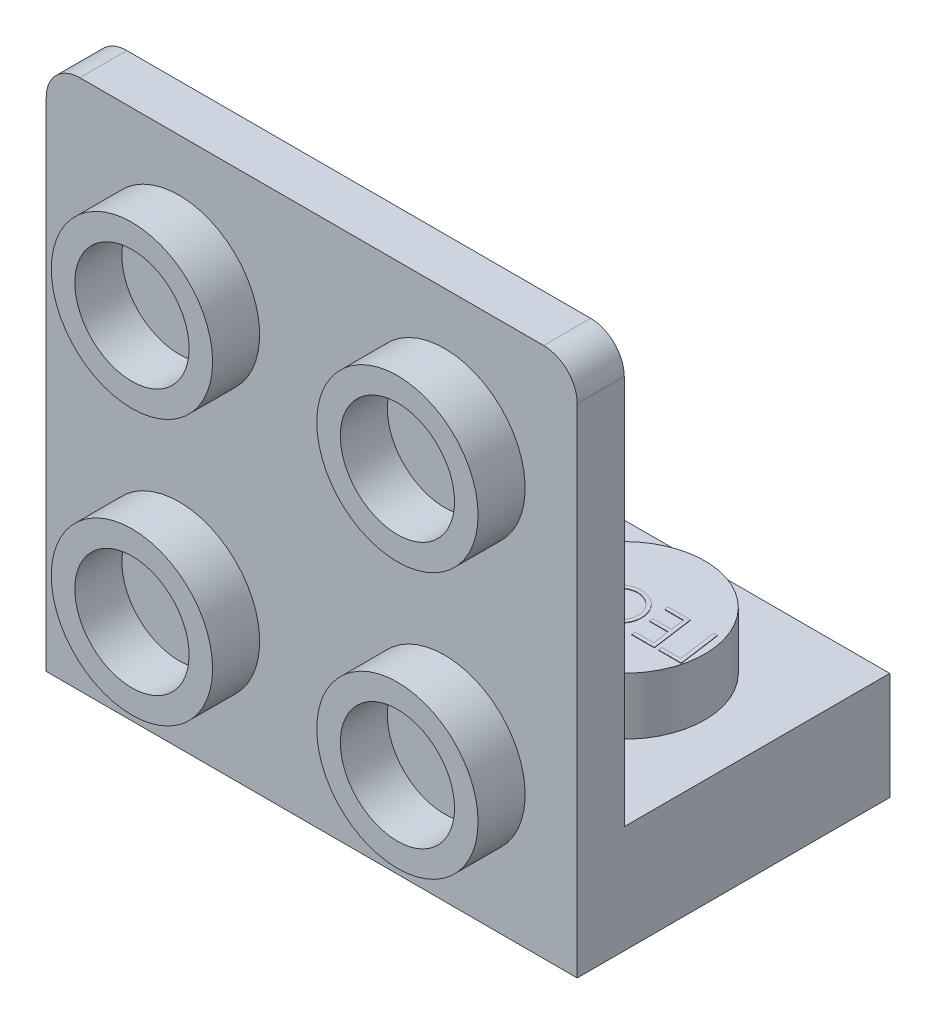
from build123d import *

# Parameters (mm, degrees)
SKETCH1_W           = 7.9
SKETCH1_H           = 7.9
BOSS_EXTRUDE1_DEPTH = 3.2
SKETCH2_R           = 2.4
BOSS_EXTRUDE2_DEPTH = 1.7
BOSS_EXTRUDE4_DEPTH = 0.01
SKETCH4_W           = 6.679581062
SKETCH4_H           = 6.679581062
CUT_EXTRUDE1_DEPTH  = 2.01
BOSS_EXTRUDE5_START = -2.01
BOSS_EXTRUDE5_DEPTH = 2.01
SKETCH6_W           = 15.8
SKETCH6_H           = 15.8
BOSS_EXTRUDE6_DEPTH = 1.4
SKETCH7_R           = 2.4
SKETCH7_R_2         = 1.7
BOSS_EXTRUDE7_DEPTH = 1.4
FILLET1_R           = 1


with BuildPart() as part:
    # Sketch1 → Boss-Extrude1 (new body)
    with BuildSketch(Plane(origin=(0, 0, 0), x_dir=(1, 0, 0), z_dir=(0, 1, 0))):
        with Locations((3.95, 3.95)):
            Rectangle(SKETCH1_W, SKETCH1_H)
    extrude(amount=BOSS_EXTRUDE1_DEPTH)

    # Sketch2 → Boss-Extrude2 (add)
    with BuildSketch(Plane(origin=(0, 3.2, 0), x_dir=(1, 0, 0), z_dir=(0, 1, 0))):
        with Locations(Location((3.95, 3.95, 0), (0, 0, 270))):
            Circle(SKETCH2_R)
    extrude(amount=BOSS_EXTRUDE2_DEPTH)

    # Sketch3 → Boss-Extrude4 (add)
    # profile 1 of 4: a face of its own
    with BuildSketch(Plane(origin=(0, 4.9, 0), x_dir=(1, 0, 0), z_dir=(0, 1, 0))):
        Polygon((1.832282536, 4.604898123), (1.945463626, 4.604898123), (1.785708017, 3.46707761), (2.346104652, 3.46707761), (2.331831815, 3.354898123), (1.657002088, 3.354898123), align=None)
    # profile 2 of 4: a face of its own
    with BuildSketch(Plane(origin=(0, 4.9, 0), x_dir=(1, 0, 0), z_dir=(0, 1, 0))):
        Polygon((3.307643113, 4.604898123), (3.289864668, 4.492718636), (2.730720036, 4.492718636), (2.672376687, 4.076051969), (3.227514908, 4.076051969), (3.211489267, 3.963872482), (2.656351046, 3.963872482), (2.586990069, 3.46707761), (3.147386703, 3.46707761), (3.132863466, 3.354898123), (2.458284139, 3.354898123), (2.633564588, 4.604898123), align=None)
    # profile 3 of 4: a face of its own
    with BuildSketch(Plane(origin=(0, 4.9, 0), x_dir=(1, 0, 0), z_dir=(0, 1, 0))):
        with BuildLine():
            Line((4.701873883, 4.341727049), (4.602214428, 4.268359661))
            add(Edge.make_bspline(
                [(4.602214428, 4.268359661), (4.594223081, 4.278463296), (4.578382454, 4.298490949), (4.552974208, 4.326751799), (4.526781942, 4.353389692), (4.49925824, 4.377917229), (4.471083571, 4.40112998), (4.441525281, 4.42204341), (4.410978563, 4.441207159), (4.379659496, 4.458649755), (4.347610579, 4.474125482), (4.315396207, 4.487732834), (4.282869127, 4.498922357), (4.250283005, 4.50864136), (4.217299487, 4.51587276), (4.18414763, 4.520710487), (4.150903008, 4.524293062), (4.128633082, 4.524610402), (4.117438786, 4.524769918)],
                knots=[0, 0, 0, 0, 1.088205139, 2.157064813, 3.209299296, 4.24303109, 5.270682624, 6.292193363, 7.299904734, 8.316436989, 9.319473328, 10.305733085, 11.269264382, 12.22444877, 13.177574148, 14.119122834, 15.054550362, 16, 16, 16, 16], degree=3))
            add(Edge.make_bspline(
                [(4.117438786, 4.524769918), (4.104994375, 4.524521107), (4.080132736, 4.524024028), (4.043033101, 4.520256885), (4.006376299, 4.51354748), (3.969908323, 4.504926578), (3.933893833, 4.493301772), (3.898252767, 4.479273564), (3.86309309, 4.462612711), (3.828430169, 4.443710217), (3.794953431, 4.422557236), (3.762954424, 4.399818018), (3.733183783, 4.375017311), (3.704650221, 4.34913067), (3.678490591, 4.320990985), (3.654040353, 4.291325456), (3.631570613, 4.259970376), (3.610753816, 4.22729124), (3.592321888, 4.193377608), (3.576332398, 4.158696131), (3.562301633, 4.123622124), (3.551463822, 4.087613068), (3.542488613, 4.051135011), (3.536702509, 4.013925289), (3.532682003, 3.976230124), (3.532229884, 3.950862463), (3.532002088, 3.938081216)],
                knots=[0, 0, 0, 0, 0.97704485, 1.95195533, 2.923843304, 3.901415526, 4.89212417, 5.89249681, 6.906854198, 7.94508701, 8.99059592, 10.014519948, 11.024825533, 12.031297736, 13.037428488, 14.038509295, 15.047964276, 16.064309815, 17.079005887, 18.075937854, 19.061713623, 20.042247028, 21.026191147, 22.008802999, 22.996754876, 24, 24, 24, 24], degree=3))
            add(Edge.make_bspline(
                [(3.532002088, 3.938081216), (3.532369323, 3.920940483), (3.533092921, 3.887166428), (3.54080397, 3.83756171), (3.552297071, 3.789703796), (3.569345009, 3.743984102), (3.590663785, 3.700113704), (3.616898701, 3.658340736), (3.647995923, 3.618632516), (3.683169388, 3.581124089), (3.721975609, 3.547190184), (3.762989457, 3.517071082), (3.806208637, 3.491553815), (3.851780792, 3.471217023), (3.899058754, 3.454481236), (3.948703848, 3.443615036), (4.000192874, 3.436168993), (4.035279814, 3.435410998), (4.053085822, 3.435026328)],
                knots=[0, 0, 0, 0, 1.019699772, 2.00921373, 2.981850619, 3.945611549, 4.907936516, 5.881372837, 6.876399243, 7.906447893, 8.938173367, 9.941073143, 10.932270214, 11.919723139, 12.908225854, 13.912405215, 14.940582182, 16, 16, 16, 16], degree=3))
            add(Edge.make_bspline(
                [(4.053085822, 3.435026328), (4.074581254, 3.435599426), (4.11748625, 3.436743331), (4.180872469, 3.447608002), (4.243162184, 3.464003995), (4.303115661, 3.48756372), (4.359892332, 3.516274774), (4.411741714, 3.54979345), (4.457784869, 3.587961635), (4.498384943, 3.630580026), (4.53303885, 3.678554542), (4.563120551, 3.731230233), (4.587740602, 3.789373269), (4.599634966, 3.830601123), (4.605720036, 3.851692995)],
                knots=[0, 0, 0, 0, 1.033792167, 2.063454529, 3.086685911, 4.12966393, 5.157365104, 6.144632769, 7.094686579, 8.02963692, 8.969786061, 9.935985671, 10.944065236, 12, 12, 12, 12], degree=3))
            Line((4.605720036, 3.851692995), (4.140976447, 3.851692995))
            Line((4.140976447, 3.851692995), (4.140976447, 3.963872482))
            Line((4.140976447, 3.963872482), (4.717899524, 3.963872482))
            add(Edge.make_bspline(
                [(4.717899524, 3.963872482), (4.715864452, 3.940537279), (4.711874195, 3.894782885), (4.69942647, 3.828086612), (4.68199329, 3.764774229), (4.659173945, 3.704861641), (4.630919519, 3.648505742), (4.59774963, 3.595348644), (4.559285746, 3.545571633), (4.515814341, 3.499721655), (4.46844757, 3.458302738), (4.417878433, 3.421925394), (4.364351012, 3.391393009), (4.308182236, 3.366007973), (4.248908241, 3.346854494), (4.187007442, 3.33278705), (4.12217798, 3.324364805), (4.078067373, 3.323359246), (4.055589828, 3.322846841)],
                knots=[0, 0, 0, 0, 1.098006248, 2.152910829, 3.176693714, 4.174102283, 5.154427425, 6.128677043, 7.108165613, 8.099464247, 9.087077226, 10.054952015, 11.015803916, 11.972468591, 12.940477937, 13.931877037, 14.946141749, 16, 16, 16, 16], degree=3))
            add(Edge.make_bspline(
                [(4.055589828, 3.322846841), (4.032525547, 3.323342362), (3.987411429, 3.324311611), (3.9214857, 3.332876212), (3.858807865, 3.34620412), (3.799404334, 3.365318809), (3.743277296, 3.389857102), (3.690679177, 3.420179827), (3.641268759, 3.455657405), (3.595689928, 3.496348401), (3.554559756, 3.541197331), (3.518567584, 3.589307242), (3.487743642, 3.639999747), (3.462901044, 3.693721351), (3.443468533, 3.750181555), (3.429856098, 3.809437188), (3.421311108, 3.871476007), (3.420325278, 3.913764014), (3.419822601, 3.935326809)],
                knots=[0, 0, 0, 0, 1.117903688, 2.186638197, 3.21780727, 4.221242465, 5.20706516, 6.182431358, 7.159609539, 8.151436913, 9.139682433, 10.10533578, 11.060397566, 12.011007066, 12.969638005, 13.950363306, 14.954883424, 16, 16, 16, 16], degree=3))
            add(Edge.make_bspline(
                [(3.419822601, 3.935326809), (3.420138952, 3.950859376), (3.420767729, 3.981731803), (3.424963713, 4.027616327), (3.432679126, 4.072646659), (3.442852825, 4.116910735), (3.455965552, 4.160496846), (3.471933961, 4.20328178), (3.491087489, 4.245242481), (3.513047729, 4.286115161), (3.537530339, 4.325600602), (3.564271155, 4.363247138), (3.593498243, 4.398542313), (3.624507556, 4.432098501), (3.658146201, 4.463054417), (3.693847346, 4.491888255), (3.731480716, 4.518905381), (3.77142415, 4.543221398), (3.812846375, 4.565137356), (3.855118915, 4.584605211), (3.898469674, 4.600573637), (3.942428974, 4.613905323), (3.987291028, 4.624144078), (4.032916476, 4.631801844), (4.079465257, 4.63599767), (4.110753822, 4.636631416), (4.12645321, 4.636949405)],
                knots=[0, 0, 0, 0, 1.01034602, 2.008157081, 2.993527994, 3.979930372, 4.960683832, 5.951959865, 6.948100503, 7.958563211, 8.967975239, 9.968308804, 10.959584837, 11.946808627, 12.938010319, 13.930059161, 14.930392727, 15.949048275, 16.969091794, 17.977364349, 18.973726886, 19.971641333, 20.963333569, 21.964771492, 22.978801278, 24, 24, 24, 24], degree=3))
            add(Edge.make_bspline(
                [(4.12645321, 4.636949405), (4.140647989, 4.63666956), (4.168739982, 4.636115737), (4.210476499, 4.63288549), (4.251380819, 4.627152534), (4.29129634, 4.618801418), (4.330484053, 4.608567941), (4.368675988, 4.59577053), (4.406070924, 4.580754735), (4.442474857, 4.563343269), (4.478143584, 4.543914061), (4.512619765, 4.521658579), (4.546625807, 4.497640881), (4.579591338, 4.471153536), (4.611552577, 4.442077414), (4.642675265, 4.410871755), (4.673242279, 4.377555225), (4.692243855, 4.353777591), (4.701873883, 4.341727049)],
                knots=[0, 0, 0, 0, 1.015105213, 2.008930748, 2.991454354, 3.966534974, 4.923490216, 5.886087319, 6.844809209, 7.803252371, 8.770243484, 9.747130909, 10.735853235, 11.746297741, 12.768902994, 13.824016992, 14.897208497, 16, 16, 16, 16], degree=3))
        make_face()
    # profile 4 of 4: a face of its own
    with BuildSketch(Plane(origin=(0, 4.9, 0), x_dir=(1, 0, 0), z_dir=(0, 1, 0))):
        with BuildLine():
            add(Edge.make_bspline(
                [(5.671925966, 4.636949405), (5.692400623, 4.63650345), (5.732667893, 4.635626396), (5.791703582, 4.627669814), (5.84816478, 4.614697282), (5.901922783, 4.596339067), (5.953136821, 4.572927607), (6.001690741, 4.544284414), (6.047399306, 4.510158163), (6.09025375, 4.471611385), (6.129154607, 4.429051867), (6.163160058, 4.383201547), (6.192058383, 4.334734533), (6.215910086, 4.283554512), (6.233823478, 4.229366588), (6.246743033, 4.172603876), (6.255145963, 4.113110877), (6.255950492, 4.072491917), (6.256361062, 4.051763107)],
                knots=[0, 0, 0, 0, 1.061681398, 2.087996504, 3.083659545, 4.062660971, 5.02945529, 5.999994507, 6.981138296, 7.983640916, 8.985844288, 9.966988076, 10.939736476, 11.908342154, 12.890058995, 13.894159216, 14.925339913, 16, 16, 16, 16], degree=3))
            add(Edge.make_bspline(
                [(6.256361062, 4.051763107), (6.25623821, 4.038988627), (6.255995471, 4.01374805), (6.253408976, 3.976225127), (6.249128591, 3.939561124), (6.243455349, 3.903597875), (6.235835613, 3.868539787), (6.226924527, 3.834140064), (6.216051359, 3.800598383), (6.20384118, 3.767696929), (6.189792262, 3.735595516), (6.173946521, 3.704324105), (6.15669213, 3.673663515), (6.137607818, 3.643838863), (6.11686312, 3.614849105), (6.094393683, 3.586665409), (6.070489857, 3.559187301), (6.044887258, 3.532733386), (6.018336956, 3.507212599), (5.990529993, 3.48355884), (5.962091012, 3.461350566), (5.932834084, 3.440746086), (5.90250067, 3.422121085), (5.871581935, 3.404690573), (5.839905885, 3.388861691), (5.807185809, 3.375183309), (5.773789823, 3.362832151), (5.739620564, 3.352089492), (5.704582969, 3.343076229), (5.668762424, 3.335500733), (5.632062087, 3.329787275), (5.594535036, 3.325855801), (5.556279304, 3.323200874), (5.530454147, 3.322965537), (5.51742877, 3.322846841)],
                knots=[0, 0, 0, 0, 1.057694632, 2.089855924, 3.112648636, 4.113725536, 5.103331559, 6.082381806, 7.055068159, 8.021768845, 8.98743121, 9.954922249, 10.923671581, 11.89959402, 12.885451751, 13.874212627, 14.883322035, 15.900071676, 16.921812937, 17.931632203, 18.921551953, 19.909055848, 20.892997665, 21.867769094, 22.84762411, 23.823252803, 24.802912784, 25.795362855, 26.787788858, 27.797679081, 28.826061376, 29.861826465, 30.921574152, 32, 32, 32, 32], degree=3))
            add(Edge.make_bspline(
                [(5.51742877, 3.322846841), (5.495540081, 3.323312388), (5.45279647, 3.324221496), (5.390401025, 3.331753811), (5.331466149, 3.34468508), (5.275615882, 3.361975519), (5.223270197, 3.38492417), (5.174339628, 3.412892082), (5.128783581, 3.445910526), (5.086763869, 3.483632016), (5.049135515, 3.525626819), (5.016044394, 3.570822838), (4.988418107, 3.619388761), (4.96538613, 3.670881503), (4.948106883, 3.725740589), (4.935156589, 3.783416472), (4.927613141, 3.844314319), (4.926699871, 3.88597706), (4.926232857, 3.907281937)],
                knots=[0, 0, 0, 0, 1.121422378, 2.189881799, 3.214223923, 4.209829567, 5.180887389, 6.136870002, 7.092517675, 8.058664933, 9.02481219, 9.976998316, 10.923432162, 11.882748215, 12.86205079, 13.865508147, 14.908495107, 16, 16, 16, 16], degree=3))
            add(Edge.make_bspline(
                [(4.926232857, 3.907281937), (4.92651465, 3.92390256), (4.927073619, 3.956871533), (4.931757127, 4.005792823), (4.939128338, 4.053761359), (4.950024433, 4.100549976), (4.963594459, 4.14639076), (4.979990494, 4.191253803), (5.000003008, 4.234848241), (5.022452359, 4.277389438), (5.047513645, 4.318359564), (5.07559856, 4.356880644), (5.105216605, 4.393691441), (5.137816677, 4.42780852), (5.172496353, 4.459796588), (5.209524734, 4.489546335), (5.248906172, 4.516814917), (5.290422211, 4.541753927), (5.333531205, 4.564369022), (5.378335052, 4.583562961), (5.424193072, 4.600182058), (5.471345954, 4.613795807), (5.519847317, 4.623918047), (5.569406413, 4.631466127), (5.620254649, 4.636113027), (5.6545551, 4.636668231), (5.671925966, 4.636949405)],
                knots=[0, 0, 0, 0, 1.027038055, 2.037251559, 3.03463374, 4.024476576, 5.003805404, 5.987972729, 6.973761106, 7.966047439, 8.95963362, 9.938921687, 10.910571097, 11.877553313, 12.852319973, 13.824735949, 14.81069978, 15.81041387, 16.816403723, 17.816876174, 18.82042938, 19.829469955, 20.847307225, 21.880377804, 22.926554263, 24, 24, 24, 24], degree=3))
        make_face()
        with BuildLine():
            add(Edge.make_bspline(
                [(5.671925966, 4.524769918), (5.65697579, 4.524545747), (5.627444828, 4.524102944), (5.583747158, 4.520086709), (5.541191397, 4.514393729), (5.499970629, 4.505322476), (5.459846772, 4.494612055), (5.421182876, 4.480527241), (5.383524652, 4.464643931), (5.34726264, 4.446055377), (5.312516644, 4.425361321), (5.279529586, 4.402463835), (5.248469657, 4.377453479), (5.219370347, 4.350164922), (5.191739723, 4.321307483), (5.166361885, 4.289965789), (5.142845474, 4.256628787), (5.121196386, 4.221501346), (5.10164712, 4.185107003), (5.08492909, 4.147719282), (5.070612165, 4.109847114), (5.058744989, 4.071497155), (5.049737471, 4.032481304), (5.043287884, 3.99291855), (5.039049877, 3.95269661), (5.03862585, 3.92565532), (5.038412344, 3.912039549)],
                knots=[0, 0, 0, 0, 1.093710758, 2.16039807, 3.20900896, 4.233234191, 5.246749975, 6.245527847, 7.241594159, 8.235879922, 9.224691631, 10.198908654, 11.171861231, 12.139893662, 13.116290872, 14.093089164, 15.087825051, 16.099756899, 17.110766713, 18.108591704, 19.094380672, 20.071961556, 21.043859171, 22.021859724, 23.00397114, 24, 24, 24, 24], degree=3))
            add(Edge.make_bspline(
                [(5.038412344, 3.912039549), (5.038625982, 3.900599914), (5.039049193, 3.877938292), (5.041777549, 3.844392517), (5.046595514, 3.811801965), (5.053065301, 3.780081073), (5.061542906, 3.749273697), (5.072183234, 3.719394567), (5.084405544, 3.690349568), (5.098393626, 3.662290632), (5.114175341, 3.635553687), (5.131389377, 3.61020951), (5.150226394, 3.586682218), (5.170360361, 3.564729612), (5.191972025, 3.544421151), (5.214980987, 3.52555365), (5.239648771, 3.508615875), (5.265465573, 3.492943288), (5.292687864, 3.479247808), (5.321165948, 3.467438697), (5.350786278, 3.457432665), (5.381544214, 3.449135171), (5.413524888, 3.442928532), (5.44663118, 3.438448028), (5.480905707, 3.435639812), (5.504152208, 3.435232585), (5.515926367, 3.435026328)],
                knots=[0, 0, 0, 0, 1.083699529, 2.146780792, 3.185591126, 4.202843058, 5.211856999, 6.209655863, 7.20532214, 8.195415879, 9.177202942, 10.14436246, 11.095191523, 12.029705806, 12.963818608, 13.902338257, 14.845476191, 15.796042213, 16.761390084, 17.729066592, 18.714222808, 19.721158958, 20.74459932, 21.797962164, 22.884686177, 24, 24, 24, 24], degree=3))
            add(Edge.make_bspline(
                [(5.515926367, 3.435026328), (5.530044188, 3.435228857), (5.558004277, 3.435629962), (5.599524853, 3.440000997), (5.64032433, 3.445959686), (5.680325762, 3.455225454), (5.71965402, 3.466535035), (5.757982705, 3.481070895), (5.795756024, 3.497476377), (5.83237428, 3.51683082), (5.867802238, 3.538111172), (5.901266528, 3.561837848), (5.932774032, 3.587459191), (5.962816859, 3.614626895), (5.990234918, 3.644356353), (6.016009711, 3.675809964), (6.039684501, 3.709331455), (6.061465654, 3.744601276), (6.080935982, 3.781209824), (6.097718361, 3.818903041), (6.112024773, 3.857287248), (6.123844079, 3.896320217), (6.132886835, 3.936161865), (6.139301688, 3.976648339), (6.14355343, 4.017951988), (6.143970816, 4.04574289), (6.144181575, 4.059775927)],
                knots=[0, 0, 0, 0, 1.029812959, 2.039525905, 3.043952503, 4.036919093, 5.033391511, 6.027870106, 7.026035071, 8.036794627, 9.047957848, 10.039952554, 11.027355318, 12.010276797, 12.992858524, 13.975534638, 14.976019862, 15.985163142, 16.99876328, 17.999396818, 18.993875413, 19.986244033, 20.973271002, 21.972624612, 22.976275263, 24, 24, 24, 24], degree=3))
            add(Edge.make_bspline(
                [(6.144181575, 4.059775927), (6.143688983, 4.077993105), (6.142724583, 4.113658826), (6.13551886, 4.16576722), (6.122807184, 4.214771606), (6.105892747, 4.261149785), (6.083400704, 4.304354629), (6.056090597, 4.344736825), (6.024020374, 4.382453222), (5.999069145, 4.404451295), (5.986429171, 4.415595238)],
                knots=[0, 0, 0, 0, 1.085318323, 2.124844004, 3.126009127, 4.096923137, 5.060061729, 6.020100862, 6.997008382, 8, 8, 8, 8], degree=3))
            add(Edge.make_bspline(
                [(5.986429171, 4.415595238), (5.97539623, 4.42431843), (5.953439426, 4.44167857), (5.917982347, 4.463870828), (5.881057133, 4.482788681), (5.842389242, 4.498145486), (5.802091847, 4.510165945), (5.760106575, 4.518646998), (5.716539836, 4.523741692), (5.686963766, 4.524423338), (5.671925966, 4.524769918)],
                knots=[0, 0, 0, 0, 0.992364662, 1.974918139, 2.947382948, 3.917989177, 4.907989082, 5.912266894, 6.938502841, 8, 8, 8, 8], degree=3))
        make_face(mode=Mode.SUBTRACT)
    extrude(amount=BOSS_EXTRUDE4_DEPTH)

    # Sketch4 → Cut-Extrude1 (cut)
    with BuildSketch(Plane.XZ):
        with Locations((3.960209469, -3.960209469)):
            Rectangle(SKETCH4_W, SKETCH4_H)
    extrude(amount=-CUT_EXTRUDE1_DEPTH, mode=Mode.SUBTRACT)

    # Sketch5 → Boss-Extrude5 (add)
    with BuildSketch(Plane(origin=(0, 3.2, 0), x_dir=(1, 0, 0), z_dir=(0, 1, 0)).offset(BOSS_EXTRUDE5_START)):
        with BuildLine():
            Line((6.369527619, 1.557811677), (5.363437843, 1.557811677))
            ThreePointArc((5.363437843, 1.557811677), (6.369527619, 0.551721901), (7.375617394, 1.557811677))
            ThreePointArc((7.375617394, 1.557811677), (7.080940521, 2.269224579), (6.369527619, 2.563901452))
            Line((6.369527619, 2.563901452), (6.369527619, 1.557811677))
        make_face()
        with BuildLine():
            Line((1.458127833, 2.579758881), (1.458127833, 1.557811677))
            Line((1.458127833, 1.557811677), (2.480075037, 1.557811677))
            ThreePointArc((2.480075037, 1.557811677), (2.180753631, 2.280437475), (1.458127833, 2.579758881))
        make_face()
        with BuildLine():
            Line((2.480075037, 1.557811677), (1.458127833, 1.557811677))
            Line((1.458127833, 1.557811677), (1.458127833, 2.579758881))
            ThreePointArc((1.458127833, 2.579758881), (0.735502035, 0.835185879), (2.480075037, 1.557811677))
        make_face()
        with BuildLine():
            ThreePointArc((5.605437996, 2.21232194), (5.425875301, 1.906719887), (5.363437843, 1.557811677))
            Line((5.363437843, 1.557811677), (6.369527619, 1.557811677))
            Line((6.369527619, 1.557811677), (6.369527619, 2.563901452))
            ThreePointArc((6.369527619, 2.563901452), (6.015263465, 2.499466361), (5.706377057, 2.31441459))
            ThreePointArc((5.706377057, 2.31441459), (5.656671092, 2.262613327), (5.605437996, 2.21232194))
        make_face()
        with BuildLine():
            ThreePointArc((7.385597221, 6.365232327), (6.369527619, 7.381301929), (5.353458016, 6.365232327))
            Line((5.353458016, 6.365232327), (6.369527619, 6.365232327))
            Line((6.369527619, 6.365232327), (6.369527619, 5.349162725))
            ThreePointArc((6.369527619, 5.349162725), (7.087997324, 5.646762621), (7.385597221, 6.365232327))
        make_face()
        with BuildLine():
            Line((6.369527619, 6.365232327), (5.353458016, 6.365232327))
            ThreePointArc((5.353458016, 6.365232327), (5.651057913, 5.646762621), (6.369527619, 5.349162725))
            Line((6.369527619, 5.349162725), (6.369527619, 6.365232327))
        make_face()
        with BuildLine():
            ThreePointArc((2.499242709, 6.365232327), (0.721948444, 7.101411716), (1.458127833, 5.324117451))
            Line((1.458127833, 5.324117451), (1.458127833, 6.365232327))
            Line((1.458127833, 6.365232327), (2.499242709, 6.365232327))
        make_face()
        with BuildLine():
            Line((1.458127833, 6.365232327), (1.458127833, 5.324117451))
            ThreePointArc((1.458127833, 5.324117451), (2.194307222, 5.629052938), (2.499242709, 6.365232327))
            Line((2.499242709, 6.365232327), (1.458127833, 6.365232327))
        make_face()
    extrude(amount=BOSS_EXTRUDE5_DEPTH)

    # Mirror1: part across plane


with BuildPart() as part_1:
    add(part.part)
    add(part.part.mirror(Plane(origin=(7.9, 3.2, 0), x_dir=(0, 0, 1), z_dir=(-1, 0, 0))))

    # Sketch6 → Boss-Extrude6 (add)
    with BuildSketch(Plane.XY):
        with Locations((7.9, 7.9)):
            Rectangle(SKETCH6_W, SKETCH6_H)
    extrude(amount=BOSS_EXTRUDE6_DEPTH)

    # Sketch7 → Boss-Extrude7 (add)
    # profile 1 of 4: a face of its own
    with BuildSketch(Plane.XY.offset(1.4)):
        with Locations(Location((3.95, 3.95, 0), (0, 0, 180))):
            Circle(SKETCH7_R)
        with Locations((3.95, 3.95)):
            Circle(SKETCH7_R_2, mode=Mode.SUBTRACT)
    # profile 2 of 4: a face of its own
    with BuildSketch(Plane.XY.offset(1.4)):
        with Locations(Location((11.85, 3.95, 0), (0, 0, 180))):
            Circle(SKETCH7_R)
        with Locations((11.85, 3.95)):
            Circle(SKETCH7_R_2, mode=Mode.SUBTRACT)
    # profile 3 of 4: a face of its own
    with BuildSketch(Plane.XY.offset(1.4)):
        with Locations(Location((11.85, 11.85, 0), (0, 0, 180))):
            Circle(SKETCH7_R)
        with Locations((11.85, 11.85)):
            Circle(SKETCH7_R_2, mode=Mode.SUBTRACT)
    # profile 4 of 4: a face of its own
    with BuildSketch(Plane.XY.offset(1.4)):
        with Locations(Location((3.95, 11.85, 0), (0, 0, 180))):
            Circle(SKETCH7_R)
        with Locations((3.95, 11.85)):
            Circle(SKETCH7_R_2, mode=Mode.SUBTRACT)
    extrude(amount=BOSS_EXTRUDE7_DEPTH)

    # Fillet1
    fillet1_edges = [part_1.edges().sort_by_distance(p)[0] for p in [
        (0, 15.8, 0.7),
        (15.8, 15.8, 0.7),
    ]]
    fillet(fillet1_edges, radius=FILLET1_R)


solid = part_1.part
